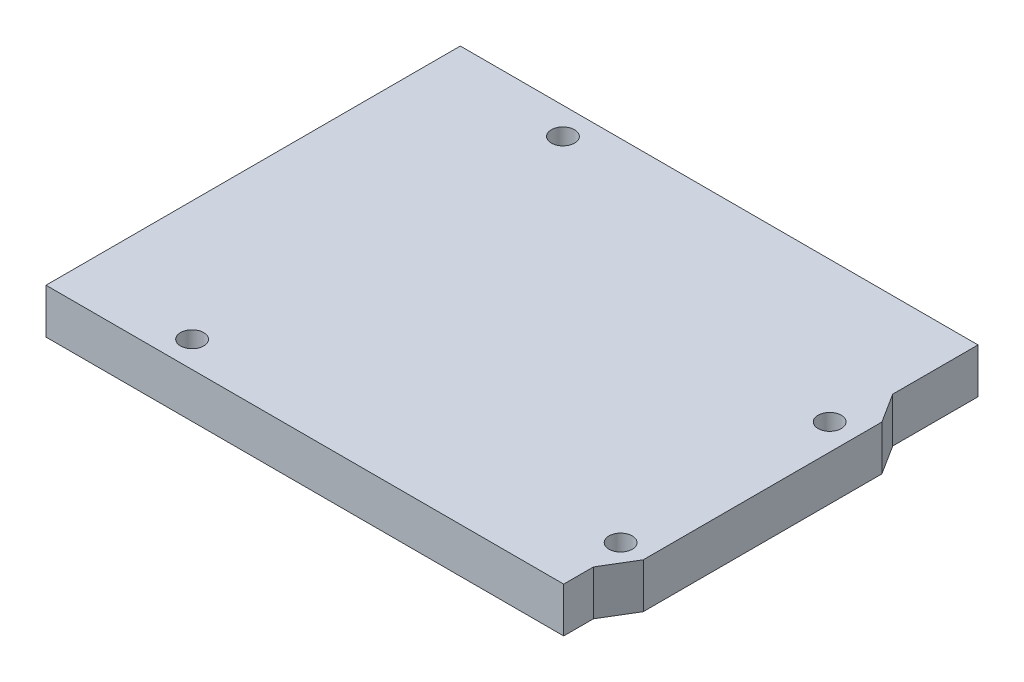
from build123d import *

# Parameters (mm, degrees)
SKETCH1_R           = 1.55
BOSS_EXTRUDE1_DEPTH = 6


with BuildPart() as part:
    # Sketch1 → Boss-Extrude1 (new body)
    with BuildSketch(Plane(origin=(0, 0, 0), x_dir=(1, 0, 0), z_dir=(0, 1, 0))):
        Polygon((34.55, 16.270655855), (37.05, 12.321449053), (37.05, -19.529653547), (34.55, -23.686069977), (34.55, -27.65), (-34.55, -27.65), (-34.55, 27.65), (34.55, 27.65), align=None)
        with Locations(Location((-17.25, 24.05, 0), (0, 0, 270))):
            Circle(SKETCH1_R, mode=Mode.SUBTRACT)
        with Locations(Location((33.55, 8.85, 0), (0, 0, 270))):
            Circle(SKETCH1_R, mode=Mode.SUBTRACT)
        with Locations(Location((33.55, -19.05, 0), (0, 0, 270))):
            Circle(SKETCH1_R, mode=Mode.SUBTRACT)
        with Locations(Location((-18.55, -24.15, 0), (0, 0, 270))):
            Circle(SKETCH1_R, mode=Mode.SUBTRACT)
    extrude(amount=BOSS_EXTRUDE1_DEPTH)


solid = part.part
